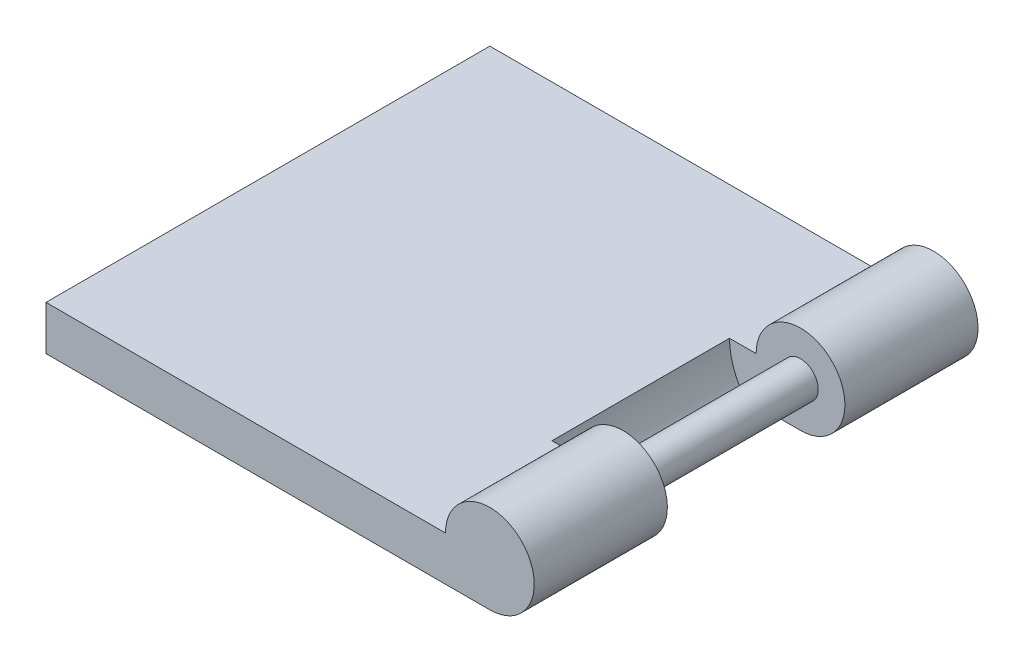
from build123d import *

# Parameters (mm, degrees)
SKETCH2_W           = 50
SKETCH2_H           = 5
BOSS_EXTRUDE1_DEPTH = 50
SKETCH3_R           = 8
CUT_EXTRUDE1_DEPTH  = 50
SKETCH4_R           = 5
BOSS_EXTRUDE2_DEPTH = 50
SKETCH6_R           = 5
CUT_EXTRUDE2_DEPTH  = 20
SKETCH7_W           = 10
SKETCH7_H           = 5
BOSS_EXTRUDE3_DEPTH = 15
LPATTERN1_COUNT     = 2
LPATTERN1_PITCH     = 35
SKETCH8_R           = 2
BOSS_EXTRUDE4_DEPTH = 50


with BuildPart() as part:
    # Sketch2 → Boss-Extrude1 (new body)
    with BuildSketch(Plane.XY):
        with Locations((-25, -2.5)):
            Rectangle(SKETCH2_W, SKETCH2_H)
    extrude(amount=-BOSS_EXTRUDE1_DEPTH)

    # Sketch3 → Cut-Extrude1 (cut)
    with BuildSketch(Plane.XY):
        Circle(SKETCH3_R)
    extrude(amount=-CUT_EXTRUDE1_DEPTH, mode=Mode.SUBTRACT)



with BuildPart() as body_2:
    # Sketch4 → Boss-Extrude2 (new body)
    with BuildSketch(Plane.XY):
        Circle(SKETCH4_R)
    extrude(amount=-BOSS_EXTRUDE2_DEPTH)

    # Sketch6 → Cut-Extrude2 (cut)
    with BuildSketch(Plane.XY.offset(-15)):
        Circle(SKETCH6_R)
    extrude(amount=-CUT_EXTRUDE2_DEPTH, mode=Mode.SUBTRACT)


with BuildPart() as cut_extrude2_piece_1:
    # of the separate pieces the step leaves, piece 1, a body of its own (cut_extrude2_pieces)
    add(body_2.part.solids().sort_by_distance((5, 0, 0))[0])


with BuildPart() as cut_extrude2_piece_2:
    # of the separate pieces the step leaves, piece 2, a body of its own (cut_extrude2_pieces)
    add(body_2.part.solids().sort_by_distance((5, 0, -35))[0])


with BuildPart() as part_1:
    add(part.part)

    add(cut_extrude2_piece_1.part)  # Boss-Extrude3 merges Cut-Extrude2 piece 1
    # Sketch7 → Boss-Extrude3 (add)
    with BuildSketch(Plane.XY):
        with Locations((-5, -2.5)):
            Rectangle(SKETCH7_W, SKETCH7_H)
    boss_extrude3 = extrude(amount=-BOSS_EXTRUDE3_DEPTH)


    add(cut_extrude2_piece_2.part)  # LPattern1 merges Cut-Extrude2 piece 2
    # LPattern1: Boss-Extrude3 ×2
    with Locations(*[(0, 0, -i * LPATTERN1_PITCH) for i in range(1, LPATTERN1_COUNT)]):
        add(boss_extrude3)

    # Sketch8 → Boss-Extrude4 (add)
    with BuildSketch(Plane.XY):
        Circle(SKETCH8_R)
    extrude(amount=-BOSS_EXTRUDE4_DEPTH)


solid = part_1.part
